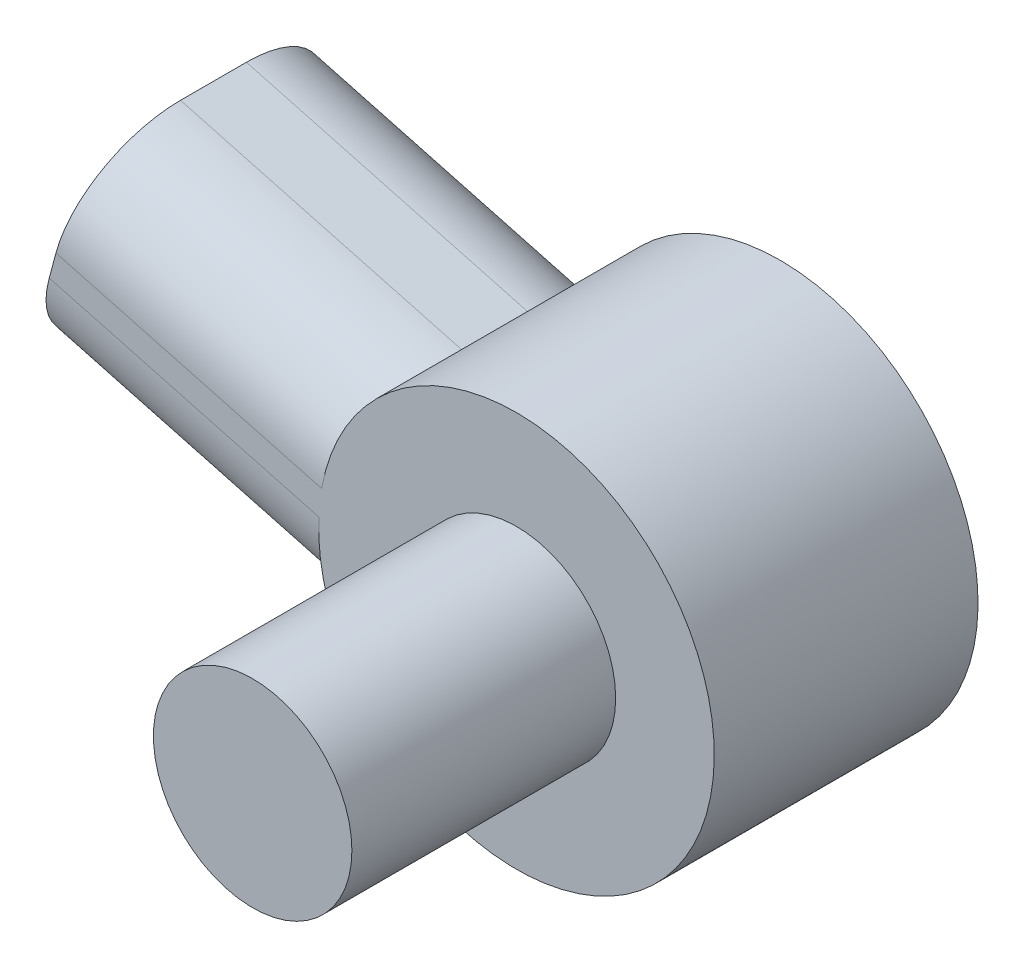
from build123d import *

# Parameters (mm, degrees)
BOSS_EXTRUDE1_DEPTH = 40
SKETCH2_R           = 15.05
CUT_EXTRUDE1_DEPTH  = 40
FILLET1_R           = 15
SKETCH3_R           = 15.05
BOSS_EXTRUDE2_DEPTH = 40


with BuildPart() as part:
    # Sketch1 → Boss-Extrude1 (new body)
    with BuildSketch(Plane.XY):
        with BuildLine():
            Line((-23.162738789, 19.065348982), (-65.942835362, 30.52824131))
            Line((-65.942835362, 30.52824131), (-74.725635473, -2.249614938))
            Line((-74.725635473, -2.249614938), (-25.7643439, -15.368753476))
            ThreePointArc((-25.7643439, -15.368753476), (29.91474065, -2.260153064), (-23.162738789, 19.065348982))
        make_face()
    extrude(amount=BOSS_EXTRUDE1_DEPTH)

    # Sketch2 → Cut-Extrude1 (cut)
    with BuildSketch(Plane(origin=(-69.157563319, 18.530713242, 0), x_dir=(0, 0, 1), z_dir=(-0.9659258262890691, 0.2588190451025179, 0))):
        with Locations((20, -4.546311876)):
            Circle(SKETCH2_R)
    extrude(amount=-CUT_EXTRUDE1_DEPTH, mode=Mode.SUBTRACT)

    # Fillet1
    fillet1_edges = [part.edges().sort_by_distance(p)[0] for p in [
        (-50.244989687, -8.809184207, 0),
        (-50.244989687, -8.809184207, 40),
        (-44.552787075, 24.796795146, 0),
        (-44.552787075, 24.796795146, 40),
    ]]
    fillet(fillet1_edges, radius=FILLET1_R)

    # Sketch3 → Boss-Extrude2 (add)
    with BuildSketch(Plane.XY.offset(40)):
        Circle(SKETCH3_R)
    extrude(amount=BOSS_EXTRUDE2_DEPTH)


solid = part.part
